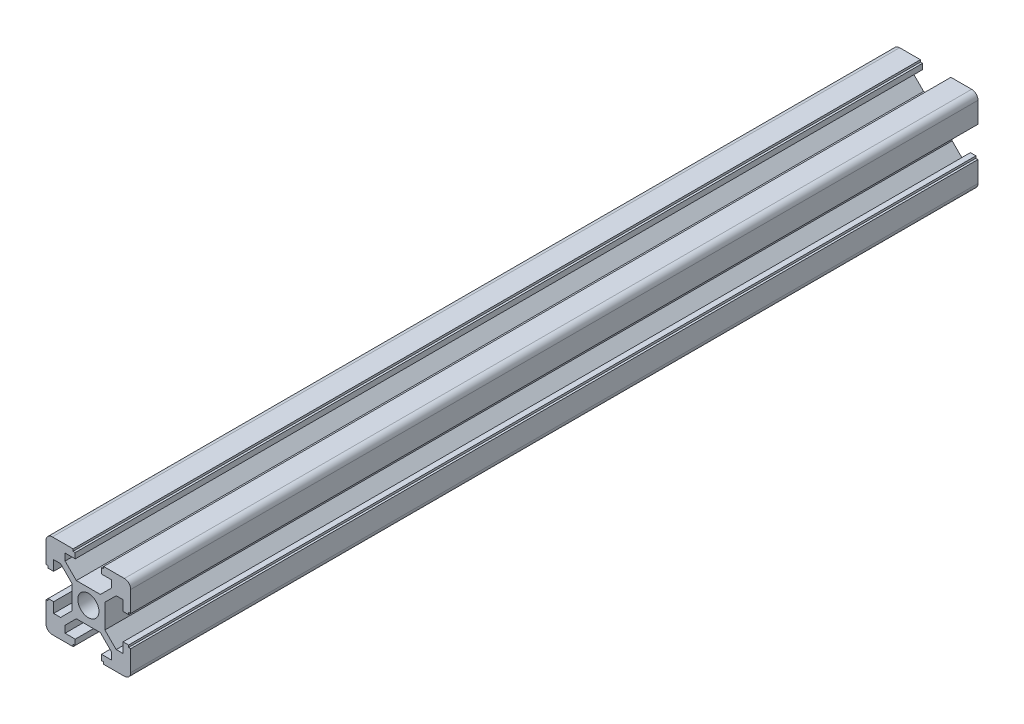
from build123d import *

# Parameters (mm, degrees)
SKETCH1_R           = 2.5
BOSS_EXTRUDE1_DEPTH = 200


with BuildPart() as part:
    # Sketch1 → Boss-Extrude1 (new body)
    with BuildSketch(Plane.XY):
        with BuildLine():
            Line((2.839339828, 3.9), (5.5, 6.560660172))
            Line((5.5, 6.560660172), (5.5, 8.2))
            Line((5.5, 8.2), (3.1, 8.2))
            Line((3.1, 8.2), (3.1, 9.5))
            Line((3.1, 9.5), (3.6, 9.5))
            Line((3.6, 9.5), (3.6, 10))
            Line((3.6, 10), (8.5, 10))
            ThreePointArc((8.5, 10), (9.560660172, 9.560660172), (10, 8.5))
            Line((10, 8.5), (10, 3.6))
            Line((10, 3.6), (9.5, 3.6))
            Line((9.5, 3.6), (9.5, 3.1))
            Line((9.5, 3.1), (8.2, 3.1))
            Line((8.2, 3.1), (8.2, 5.5))
            Line((8.2, 5.5), (6.560660172, 5.5))
            Line((6.560660172, 5.5), (3.9, 2.839339828))
            Line((3.9, 2.839339828), (3.9, -2.839339828))
            Line((3.9, -2.839339828), (6.560660172, -5.5))
            Line((6.560660172, -5.5), (8.2, -5.5))
            Line((8.2, -5.5), (8.2, -3.1))
            Line((8.2, -3.1), (9.5, -3.1))
            Line((9.5, -3.1), (9.5, -3.6))
            Line((9.5, -3.6), (10, -3.6))
            Line((10, -3.6), (10, -8.5))
            ThreePointArc((10, -8.5), (9.560660172, -9.560660172), (8.5, -10))
            Line((8.5, -10), (3.6, -10))
            Line((3.6, -10), (3.6, -9.5))
            Line((3.6, -9.5), (3.1, -9.5))
            Line((3.1, -9.5), (3.1, -8.2))
            Line((3.1, -8.2), (5.5, -8.2))
            Line((5.5, -8.2), (5.5, -6.560660172))
            Line((5.5, -6.560660172), (2.839339828, -3.9))
            Line((2.839339828, -3.9), (-2.839339828, -3.9))
            Line((-2.839339828, -3.9), (-5.5, -6.560660172))
            Line((-5.5, -6.560660172), (-5.5, -8.2))
            Line((-5.5, -8.2), (-3.1, -8.2))
            Line((-3.1, -8.2), (-3.1, -9.5))
            Line((-3.1, -9.5), (-3.6, -9.5))
            Line((-3.6, -9.5), (-3.6, -10))
            Line((-3.6, -10), (-8.5, -10))
            ThreePointArc((-8.5, -10), (-9.560660172, -9.560660172), (-10, -8.5))
            Line((-10, -8.5), (-10, -3.6))
            Line((-10, -3.6), (-9.5, -3.6))
            Line((-9.5, -3.6), (-9.5, -3.1))
            Line((-9.5, -3.1), (-8.2, -3.1))
            Line((-8.2, -3.1), (-8.2, -5.5))
            Line((-8.2, -5.5), (-6.560660172, -5.5))
            Line((-6.560660172, -5.5), (-3.9, -2.839339828))
            Line((-3.9, -2.839339828), (-3.9, 2.839339828))
            Line((-3.9, 2.839339828), (-6.560660172, 5.5))
            Line((-6.560660172, 5.5), (-8.2, 5.5))
            Line((-8.2, 5.5), (-8.2, 3.1))
            Line((-8.2, 3.1), (-9.5, 3.1))
            Line((-9.5, 3.1), (-9.5, 3.6))
            Line((-9.5, 3.6), (-10, 3.6))
            Line((-10, 3.6), (-10, 8.5))
            ThreePointArc((-10, 8.5), (-9.560660172, 9.560660172), (-8.5, 10))
            Line((-8.5, 10), (-3.6, 10))
            Line((-3.6, 10), (-3.6, 9.5))
            Line((-3.6, 9.5), (-3.1, 9.5))
            Line((-3.1, 9.5), (-3.1, 8.2))
            Line((-3.1, 8.2), (-5.5, 8.2))
            Line((-5.5, 8.2), (-5.5, 6.560660172))
            Line((-5.5, 6.560660172), (-2.839339828, 3.9))
            Line((-2.839339828, 3.9), (2.839339828, 3.9))
        make_face()
        with Locations((0, 0.235847297)):
            Circle(SKETCH1_R, mode=Mode.SUBTRACT)
    extrude(amount=BOSS_EXTRUDE1_DEPTH)


solid = part.part
